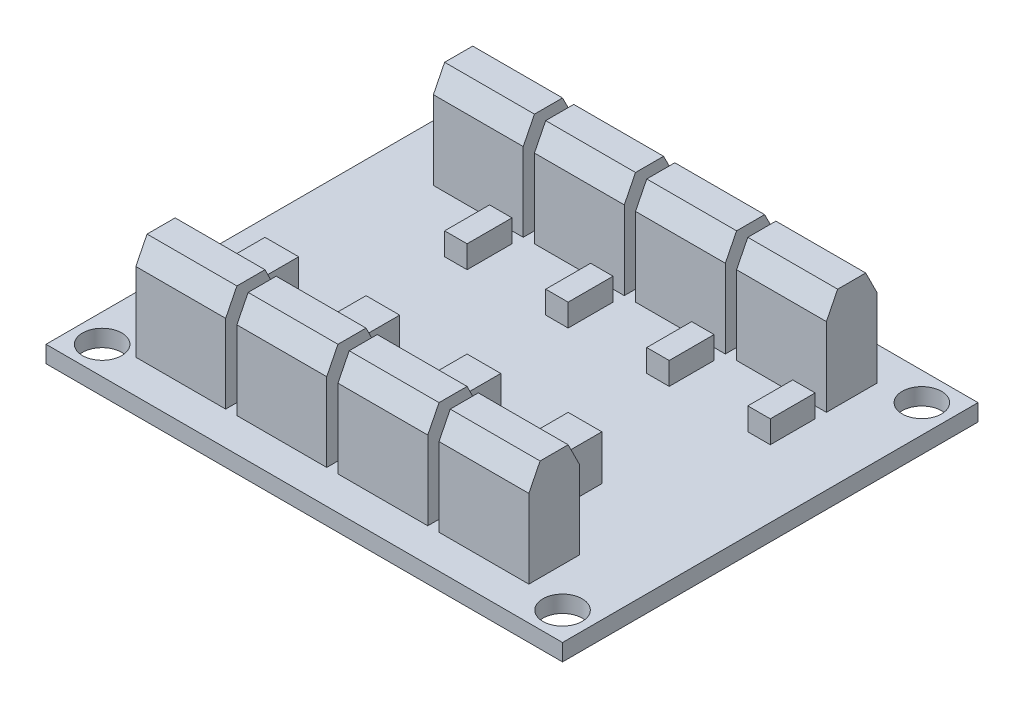
from build123d import *

# Parameters (mm, degrees)
SKETCH1_W           = 46
SKETCH1_H           = 37
SKETCH1_R           = 1.75
BOSS_EXTRUDE1_DEPTH = 0.75
SKETCH2_W           = 8
SKETCH2_H           = 4.5
BOSS_EXTRUDE2_DEPTH = 9
CUT_EXTRUDE2_DEPTH  = 124
SKETCH4_W           = 2
SKETCH4_H           = 4
BOSS_EXTRUDE3_DEPTH = 2
SKETCH5_W           = 3
SKETCH5_H           = 5
BOSS_EXTRUDE4_DEPTH = 4


with BuildPart() as part:
    # Sketch1 → Boss-Extrude1 (new, symmetric)
    with BuildSketch(Plane(origin=(0, 0, 0), x_dir=(1, 0, 0), z_dir=(0, 1, 0))):
        Rectangle(SKETCH1_W, SKETCH1_H)
        with Locations(Location((20.5, 16, 0), (0, 0, 270))):
            Circle(SKETCH1_R, mode=Mode.SUBTRACT)
        with Locations(Location((20.5, -16, 0), (0, 0, 90))):
            Circle(SKETCH1_R, mode=Mode.SUBTRACT)
        with Locations(Location((-20.5, -16, 0), (0, 0, 270))):
            Circle(SKETCH1_R, mode=Mode.SUBTRACT)
        with Locations(Location((-20.5, 16, 0), (0, 0, 90))):
            Circle(SKETCH1_R, mode=Mode.SUBTRACT)
    extrude(amount=BOSS_EXTRUDE1_DEPTH, both=True)

    # Sketch2 → Boss-Extrude2 (add)
    with BuildSketch(Plane(origin=(0, 0.75, 0), x_dir=(1, 0, 0), z_dir=(0, 1, 0))):
        with Locations((13, 13.25)):
            Rectangle(SKETCH2_W, SKETCH2_H)
        with Locations((4, 13.25)):
            Rectangle(SKETCH2_W, SKETCH2_H)
        with Locations((-5, 13.25)):
            Rectangle(SKETCH2_W, SKETCH2_H)
        with Locations((-14, 13.25)):
            Rectangle(SKETCH2_W, SKETCH2_H)
        with Locations((-14, -13.25)):
            Rectangle(SKETCH2_W, SKETCH2_H)
        with Locations((-5, -13.25)):
            Rectangle(SKETCH2_W, SKETCH2_H)
        with Locations((4, -13.25)):
            Rectangle(SKETCH2_W, SKETCH2_H)
        with Locations((13, -13.25)):
            Rectangle(SKETCH2_W, SKETCH2_H)
    extrude(amount=BOSS_EXTRUDE2_DEPTH)

    # Sketch3 → Cut-Extrude2 (cut)
    with BuildSketch(Plane(origin=(17, 0, 0), x_dir=(0, 0, -1), z_dir=(1, 0, 0))):
        Polygon((-15.5, 9.75), (-15.5, 7.75), (-14.5, 9.75), align=None)
        Polygon((-11, 9.75), (-12, 9.75), (-11, 7.75), align=None)
        Polygon((12, 9.75), (11, 9.75), (11, 7.75), align=None)
        Polygon((15.5, 7.75), (14.5, 9.75), (15.5, 9.75), align=None)
    extrude(amount=-CUT_EXTRUDE2_DEPTH, mode=Mode.SUBTRACT)

    # Sketch4 → Boss-Extrude3 (add)
    with BuildSketch(Plane(origin=(0, 0.75, 0), x_dir=(1, 0, 0), z_dir=(0, 1, 0))):
        with Locations((16, 8)):
            Rectangle(SKETCH4_W, SKETCH4_H)
        with Locations((7, 8)):
            Rectangle(SKETCH4_W, SKETCH4_H)
        with Locations((-2, 8)):
            Rectangle(SKETCH4_W, SKETCH4_H)
        with Locations((-11, 8)):
            Rectangle(SKETCH4_W, SKETCH4_H)
    extrude(amount=BOSS_EXTRUDE3_DEPTH)

    # Sketch5 → Boss-Extrude4 (add)
    with BuildSketch(Plane(origin=(0, 0.75, 0), x_dir=(1, 0, 0), z_dir=(0, 1, 0))):
        with Locations((-16, -7)):
            Rectangle(SKETCH5_W, SKETCH5_H)
        with Locations((-7, -7)):
            Rectangle(SKETCH5_W, SKETCH5_H)
        with Locations((2, -7)):
            Rectangle(SKETCH5_W, SKETCH5_H)
        with Locations((11, -7)):
            Rectangle(SKETCH5_W, SKETCH5_H)
    extrude(amount=BOSS_EXTRUDE4_DEPTH)


solid = part.part
